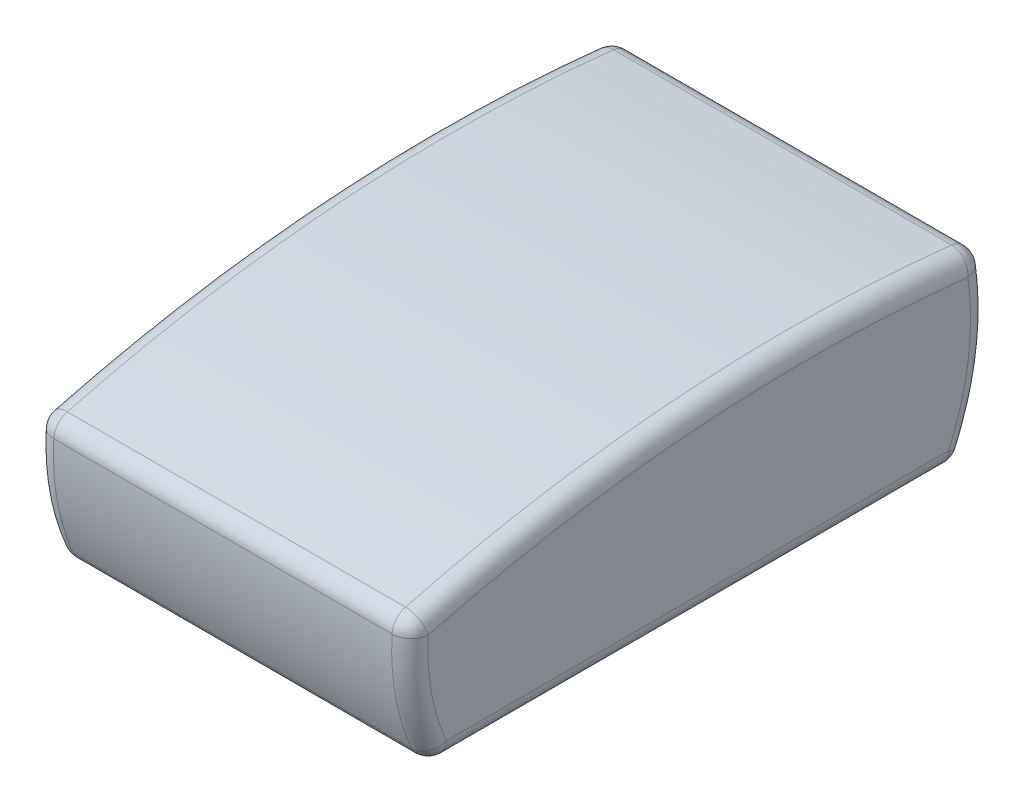
from build123d import *

# Parameters (mm, degrees)
BOSS_EXTRUDE1_DEPTH = 62
FILLET1_R           = 3
SKETCH2_R           = 4
CUT_EXTRUDE1_DEPTH  = 20


with BuildPart() as part:
    # Sketch1 → Boss-Extrude1 (new body)
    with BuildSketch(Plane(origin=(0, 0, 0), x_dir=(0, 0, -1), z_dir=(1, 0, 0))):
        with BuildLine():
            Line((-43.5, 0), (43.5, 0))
            ThreePointArc((43.5, 0), (47.853804482, 14.177339776), (47.362560683, 29))
            ThreePointArc((47.362560683, 29), (-0.343872677, 30.041597997), (-47.379193576, 22))
            ThreePointArc((-47.379193576, 22), (-47.006596643, 10.723695647), (-43.5, 0))
        make_face()
    extrude(amount=BOSS_EXTRUDE1_DEPTH)

    # Fillet1
    fillet1_edges = [part.edges().sort_by_distance(p)[0] for p in [
        (62, 14.177339776, -47.853804482),
        (62, 30.041597997, 0.343872677),
        (62, 10.723695647, 47.006596643),
        (0, 30.041597997, 0.343872677),
        (0, 14.177339776, -47.853804482),
        (0, 0, 0),
        (0, 10.723695647, 47.006596643),
        (62, 0, 0),
        (31, 22, 47.379193576),
        (31, 29, -47.362560683),
        (31, 0, -43.5),
        (31, 0, 43.5),
    ]]
    fillet(fillet1_edges, radius=FILLET1_R)

    # Sketch2 → Cut-Extrude1 (cut)
    with BuildSketch(Plane.XZ):
        with Locations((11, 5.614286523)):
            Circle(SKETCH2_R)
        with BuildLine():
            ThreePointArc((15, 5.614286523), (11, 1.614286523), (7, 5.614286523))
            Line((7, 5.614286523), (7, -2.442860068))
            ThreePointArc((7, -2.442860068), (11, 1.557139932), (15, -2.442860068))
            Line((15, -2.442860068), (15, 5.614286523))
        make_face()
        with BuildLine():
            ThreePointArc((15, -2.442860068), (11, 1.557139932), (7, -2.442860068))
            Line((7, -2.442860068), (15, -2.442860068))
        make_face()
        with BuildLine():
            Line((15, -2.442860068), (7, -2.442860068))
            ThreePointArc((7, -2.442860068), (11, -6.442860068), (15, -2.442860068))
        make_face()
        with Locations((51, -2.442860068)):
            Circle(SKETCH2_R)
        with BuildLine():
            Line((47, 5.614286523), (47, -2.442860068))
            ThreePointArc((47, -2.442860068), (51, 1.557139932), (55, -2.442860068))
            Line((55, -2.442860068), (55, 5.614286523))
            ThreePointArc((55, 5.614286523), (51, 1.614286523), (47, 5.614286523))
        make_face()
        with Locations((51, 5.614286523)):
            Circle(SKETCH2_R)
    extrude(amount=-CUT_EXTRUDE1_DEPTH, mode=Mode.SUBTRACT)


solid = part.part
